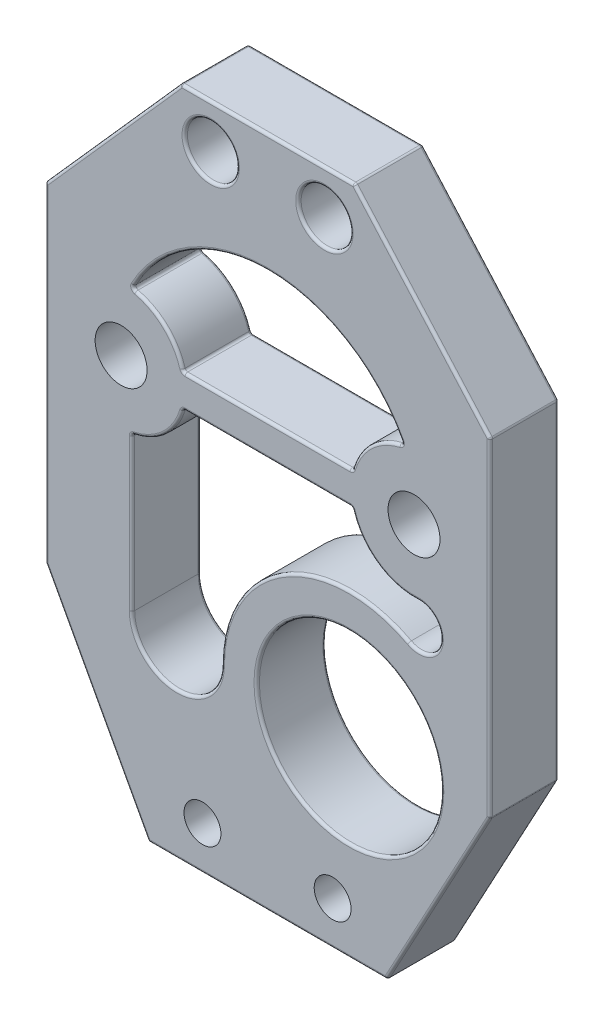
from build123d import *

# Parameters (mm, degrees)
ESBO_O1_R                = 2.395
ESBO_O1_R_2              = 1.5
ESBO_O1_R_3              = 8.5
RESSALTO_EXTRUS_O1_DEPTH = 6.35
FILETE1_R                = 0.25
SKETCH_1_R               = 3.248462934
SKETCH_1_R_2             = 2.395
SKETCH_1_R_3             = 3.322627998
EXTRUDE_1_DEPTH          = 6.35
SKETCH_2_R               = 1.7
CUT_EXTRUDE_1_DEPTH      = 6.35


with BuildPart() as part:
    # Esboço1 → Ressalto-extrusão1 (new body)
    with BuildSketch(Plane.XY):
        Polygon((-7.99, 62), (7.99, 62), (20.5, 47.9), (20.5, 17.6), (11, 0), (-11, 0), (-20.5, 17.6), (-20.5, 47.9), align=None)
        with Locations((5.24, 58)):
            Circle(ESBO_O1_R, mode=Mode.SUBTRACT)
        with Locations((-5.24, 58)):
            Circle(ESBO_O1_R, mode=Mode.SUBTRACT)
        with Locations((6, 4)):
            Circle(ESBO_O1_R_2, mode=Mode.SUBTRACT)
        with Locations((-6, 4)):
            Circle(ESBO_O1_R_2, mode=Mode.SUBTRACT)
        with Locations((7.5, 17.6)):
            Circle(ESBO_O1_R_3, mode=Mode.SUBTRACT)
        with Locations((13.5, 37.6)):
            Circle(ESBO_O1_R, mode=Mode.SUBTRACT)
        with Locations((-13.5, 37.6)):
            Circle(ESBO_O1_R, mode=Mode.SUBTRACT)
        with BuildLine():
            Line((-7.793862953, 39.1), (7.793862953, 39.1))
            ThreePointArc((7.793862953, 39.1), (9.511169252, 41.94732438), (12.495413112, 43.413845989))
            ThreePointArc((12.495413112, 43.413845989), (0, 51.1), (-12.495413112, 43.413845989))
            ThreePointArc((-12.495413112, 43.413845989), (-9.511169252, 41.94732438), (-7.793862953, 39.1))
        make_face(mode=Mode.SUBTRACT)
        with BuildLine():
            Line((-12.495413112, 31.786154011), (-12.495413112, 17.6))
            ThreePointArc((-12.495413112, 17.6), (-8.36, 13.464586888), (-4.224586888, 17.6))
            ThreePointArc((-4.224586888, 17.6), (1.465365447, 27.652319311), (13.012544702, 27.947839804))
            ThreePointArc((13.012544702, 27.947839804), (15.906382409, 29.2842218), (13.838229798, 31.709702842))
            ThreePointArc((13.838229798, 31.709702842), (10.032683409, 32.826351955), (7.793862953, 36.1))
            Line((7.793862953, 36.1), (-7.793862953, 36.1))
            ThreePointArc((-7.793862953, 36.1), (-9.511169252, 33.25267562), (-12.495413112, 31.786154011))
        make_face(mode=Mode.SUBTRACT)
    extrude(amount=RESSALTO_EXTRUS_O1_DEPTH)

    # Filete1
    filete1_edges = [part.edges().sort_by_distance(p)[0] for p in [
        (0, 0, 0),
        (-15.75, 8.8, 0),
        (-20.5, 32.75, 0),
        (-14.245, 54.95, 0),
        (-15.75, 8.8, 6.35),
        (-7.99, 62, 3.175),
        (7.99, 62, 3.175),
        (20.5, 47.9, 3.175),
        (20.5, 17.6, 3.175),
        (11, 0, 3.175),
        (-11, 0, 3.175),
        (-20.5, 17.6, 3.175),
        (-20.5, 47.9, 3.175),
        (0, 0, 6.35),
        (15.75, 8.8, 6.35),
        (-7.635, 58, 0),
        (-7.635, 58, 6.35),
        (20.5, 32.75, 6.35),
        (2.845, 58, 0),
        (2.845, 58, 6.35),
        (14.245, 54.95, 6.35),
        (0, 62, 6.35),
        (-1, 17.6, 0),
        (-1, 17.6, 6.35),
        (11.105, 37.6, 0),
        (11.105, 37.6, 6.35),
        (-15.895, 37.6, 0),
        (-15.895, 37.6, 6.35),
        (-14.245, 54.95, 6.35),
        (-9.511169252, 41.94732438, 0),
        (-12.495413112, 43.413845989, 3.175),
        (0, 39.1, 0),
        (-7.793862953, 39.1, 3.175),
        (9.511169252, 41.94732438, 0),
        (7.793862953, 39.1, 3.175),
        (0, 51.1, 0),
        (12.495413112, 43.413845989, 3.175),
        (-9.511169252, 41.94732438, 6.35),
        (0, 39.1, 6.35),
        (9.511169252, 41.94732438, 6.35),
        (0, 51.1, 6.35),
        (-9.511169252, 33.25267562, 0),
        (-7.793862953, 36.1, 3.175),
        (-12.495413112, 24.693077006, 0),
        (-12.495413112, 31.786154011, 3.175),
        (-8.36, 13.464586888, 0),
        (1.465365447, 27.652319311, 0),
        (15.906382409, 29.2842218, 0),
        (10.032683409, 32.826351955, 0),
        (0, 36.1, 0),
        (7.793862953, 36.1, 3.175),
        (-9.511169252, 33.25267562, 6.35),
        (-12.495413112, 24.693077006, 6.35),
        (-8.36, 13.464586888, 6.35),
        (1.465365447, 27.652319311, 6.35),
        (15.906382409, 29.2842218, 6.35),
        (10.032683409, 32.826351955, 6.35),
        (0, 36.1, 6.35),
        (0, 62, 0),
        (-20.5, 32.75, 6.35),
        (14.245, 54.95, 0),
        (20.5, 32.75, 0),
        (15.75, 8.8, 0),
    ]]
    fillet(filete1_edges, radius=FILETE1_R)

    # 草图1 → 凸台-拉伸1 (add)
    # profile 1 of 2: a face of its own
    with BuildSketch(Plane.XY):
        with Locations((-13.5, 37.6)):
            Circle(SKETCH_1_R)
        with Locations((-13.5, 37.6)):
            Circle(SKETCH_1_R_2, mode=Mode.SUBTRACT)
    # profile 2 of 2: a face of its own
    with BuildSketch(Plane.XY):
        with Locations((13.5, 37.6)):
            Circle(SKETCH_1_R_3)
        with Locations((13.5, 37.6)):
            Circle(SKETCH_1_R_2, mode=Mode.SUBTRACT)
    extrude(amount=EXTRUDE_1_DEPTH)

    # 草图2 → 切除-拉伸1 (cut)
    with BuildSketch(Plane.XY):
        with Locations((-6, 4)):
            Circle(SKETCH_2_R)
        with Locations((6, 4)):
            Circle(SKETCH_2_R)
    extrude(amount=CUT_EXTRUDE_1_DEPTH, mode=Mode.SUBTRACT)


solid = part.part
